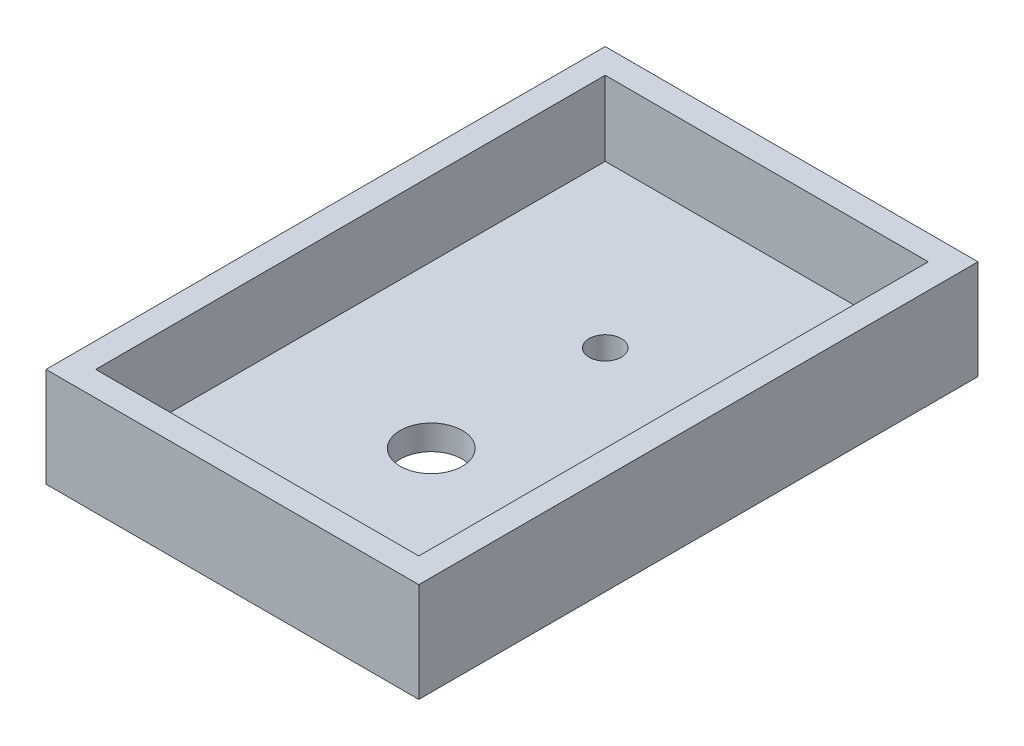
from build123d import *

# Parameters (mm, degrees)
SKETCH1_W           = 38.1
SKETCH1_H           = 57.15
BOSS_EXTRUDE1_DEPTH = 10.16
SHELL1_T            = -2.54
SKETCH3_R           = 1.651
SKETCH3_R_2         = 3.175
CUT_EXTRUDE1_DEPTH  = 27.94


with BuildPart() as part:
    # Sketch1 → Boss-Extrude1 (new body)
    with BuildSketch(Plane(origin=(0, 0, 0), x_dir=(1, 0, 0), z_dir=(0, 1, 0))):
        with Locations((19.05, 28.575)):
            Rectangle(SKETCH1_W, SKETCH1_H)
    extrude(amount=BOSS_EXTRUDE1_DEPTH)

    # Shell1
    shell1_openings = [part.faces().sort_by_distance(p)[0] for p in [
        (19.05, 10.16, -28.575),
    ]]
    offset(amount=SHELL1_T, openings=shell1_openings, kind=Kind.INTERSECTION)

    # Sketch3 → Cut-Extrude1 (cut)
    with BuildSketch(Plane.XZ):
        with Locations(Location((19.05, -38.1, 0), (0, 0, 270))):
            Circle(SKETCH3_R)
        with Locations(Location((19.05, -20.32, 0), (0, 0, 270))):
            Circle(SKETCH3_R_2)
    extrude(amount=-CUT_EXTRUDE1_DEPTH, mode=Mode.SUBTRACT)


solid = part.part
